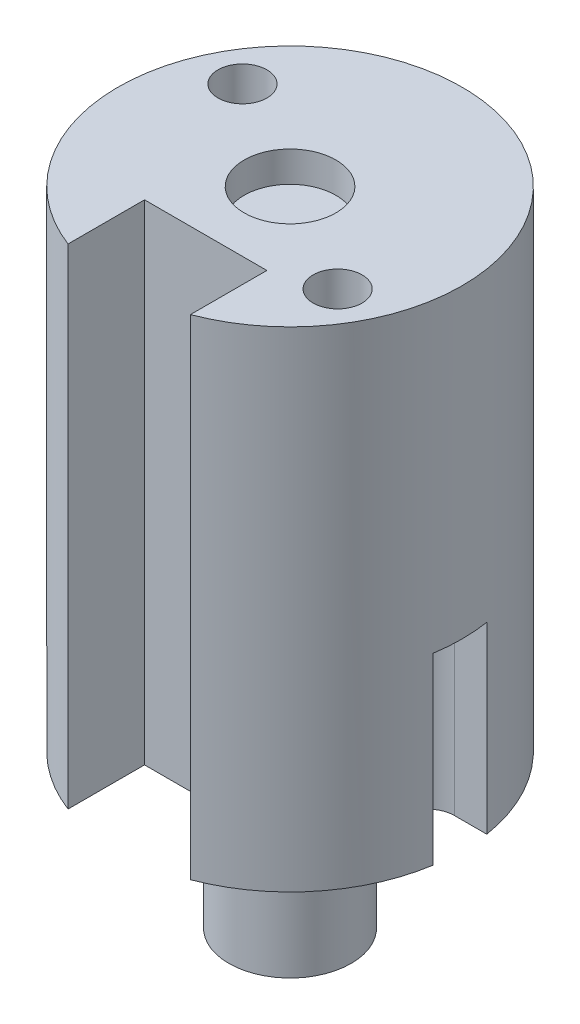
from build123d import *

# Parameters (mm, degrees)
SKETCH_1_R          = 11.25
EXTRUDE_1_DEPTH     = 32
SKETCH_3_R          = 1.21
CUT_EXTRUDE_1_DEPTH = 30
SKETCH_4_R          = 4
EXTRUDE_2_DEPTH     = 10
CUT_EXTRUDE_2_DEPTH = 10
CHAMFER_1_SIZE      = 1
SKETCH_6_W          = 8
SKETCH_6_H          = 5
CUT_EXTRUDE_3_DEPTH = 45.912414765
SKETCH_7_R          = 1.6
CUT_EXTRUDE_4_DEPTH = 6
SKETCH_8_R          = 3
CUT_EXTRUDE_5_DEPTH = 2
CUT_EXTRUDE_6_DEPTH = 12


with BuildPart() as part:
    # 草图1 → 凸台-拉伸1 (new body)
    with BuildSketch(Plane(origin=(0, 0, 0), x_dir=(1, 0, 0), z_dir=(0, 1, 0))):
        with Locations(Location((0, 0, 0), (0, 0, 270))):
            Circle(SKETCH_1_R)
    extrude(amount=EXTRUDE_1_DEPTH)

    # 草图3 → 切除-拉伸1 (cut)
    with BuildSketch(Plane.XZ):
        with Locations(Location((9, 0, 0), (0, 0, 270))):
            Circle(SKETCH_3_R)
        with Locations(Location((-9, 0, 0), (0, 0, 90))):
            Circle(SKETCH_3_R)
    extrude(amount=-CUT_EXTRUDE_1_DEPTH, mode=Mode.SUBTRACT)

    # 草图4 → 凸台-拉伸2 (add)
    with BuildSketch(Plane.XZ):
        with Locations(Location((0, 0, 0), (0, 0, 90))):
            Circle(SKETCH_4_R)
    extrude(amount=EXTRUDE_2_DEPTH)

    # 草图5 → 切除-拉伸2 (cut)
    with BuildSketch(Plane.XZ.offset(10)):
        Polygon((0, -2.909845357), (2.52, -1.454922678), (2.52, 1.454922678), (0, 2.909845357), (-2.52, 1.454922678), (-2.52, -1.454922678), align=None)
    extrude(amount=-CUT_EXTRUDE_2_DEPTH, mode=Mode.SUBTRACT)

    # 倒角1
    chamfer_1_edges = [part.edges().sort_by_distance(p)[0] for p in [
        (0, 0, -4),
    ]]
    chamfer(chamfer_1_edges, length=CHAMFER_1_SIZE)

    # 草图6 → 切除-拉伸3 (cut, through all)
    with BuildSketch(Plane(origin=(0, 32, 0), x_dir=(1, 0, 0), z_dir=(0, 1, 0))):
        with Locations((0, -8.014870422)):
            Rectangle(SKETCH_6_W, SKETCH_6_H)
        with BuildLine():
            Line((4, -10.514870422), (-4, -10.514870422))
            ThreePointArc((-4, -10.514870422), (0, -11.25), (4, -10.514870422))
        make_face()
    extrude(amount=-CUT_EXTRUDE_3_DEPTH, mode=Mode.SUBTRACT)

    # 草图7 → 切除-拉伸4 (cut)
    with BuildSketch(Plane(origin=(0, 32, 0), x_dir=(1, 0, 0), z_dir=(0, 1, 0))):
        with Locations(Location((-7.361215932, 4.25, 0), (0, 0, 270))):
            Circle(SKETCH_7_R)
        with Locations(Location((7.361215932, -4.25, 0), (0, 0, 90))):
            Circle(SKETCH_7_R)
    extrude(amount=-CUT_EXTRUDE_4_DEPTH, mode=Mode.SUBTRACT)

    # 草图8 → 切除-拉伸5 (cut)
    with BuildSketch(Plane(origin=(0, 32, 0), x_dir=(1, 0, 0), z_dir=(0, 1, 0))):
        with Locations(Location((0, 0, 0), (0, 0, 270))):
            Circle(SKETCH_8_R)
    extrude(amount=-CUT_EXTRUDE_5_DEPTH, mode=Mode.SUBTRACT)

    # 草图9 → 切除-拉伸6 (cut)
    with BuildSketch(Plane.XZ):
        with BuildLine():
            ThreePointArc((-11.113055385, 1.75), (-11.25, 0), (-11.113055385, -1.75))
            Line((-11.113055385, -1.75), (-9, -1.75))
            ThreePointArc((-9, -1.75), (-10.75, 0), (-9, 1.75))
            Line((-9, 1.75), (-11.113055385, 1.75))
        make_face()
        with BuildLine():
            ThreePointArc((-9, 1.75), (-10.75, 0), (-9, -1.75))
            Line((-9, -1.75), (-9, -1.21))
            ThreePointArc((-9, -1.21), (-10.21, 0), (-9, 1.21))
            Line((-9, 1.21), (-9, 1.75))
        make_face()
        with BuildLine():
            Line((-9, -1.21), (-9, -1.75))
            ThreePointArc((-9, -1.75), (-7.762563133, -1.237436867), (-7.25, 0))
            ThreePointArc((-7.25, 0), (-7.762563133, 1.237436867), (-9, 1.75))
            Line((-9, 1.75), (-9, 1.21))
            ThreePointArc((-9, 1.21), (-8.144400795, 0.855599205), (-7.79, 0))
            ThreePointArc((-7.79, 0), (-8.144400795, -0.855599205), (-9, -1.21))
        make_face()
        with BuildLine():
            ThreePointArc((9, 1.75), (7.25, 0), (9, -1.75))
            Line((9, -1.75), (9, -1.21))
            ThreePointArc((9, -1.21), (7.79, 0), (9, 1.21))
            Line((9, 1.21), (9, 1.75))
        make_face()
        with BuildLine():
            Line((9, -1.21), (9, -1.75))
            ThreePointArc((9, -1.75), (10.237436867, -1.237436867), (10.75, 0))
            ThreePointArc((10.75, 0), (10.237436867, 1.237436867), (9, 1.75))
            Line((9, 1.75), (9, 1.21))
            ThreePointArc((9, 1.21), (9.855599205, 0.855599205), (10.21, 0))
            ThreePointArc((10.21, 0), (9.855599205, -0.855599205), (9, -1.21))
        make_face()
        with BuildLine():
            Line((9, -1.75), (11.113055385, -1.75))
            ThreePointArc((11.113055385, -1.75), (11.25, 0), (11.113055385, 1.75))
            Line((11.113055385, 1.75), (9, 1.75))
            ThreePointArc((9, 1.75), (10.237436867, 1.237436867), (10.75, 0))
            ThreePointArc((10.75, 0), (10.237436867, -1.237436867), (9, -1.75))
        make_face()
    extrude(amount=-CUT_EXTRUDE_6_DEPTH, mode=Mode.SUBTRACT)


solid = part.part
